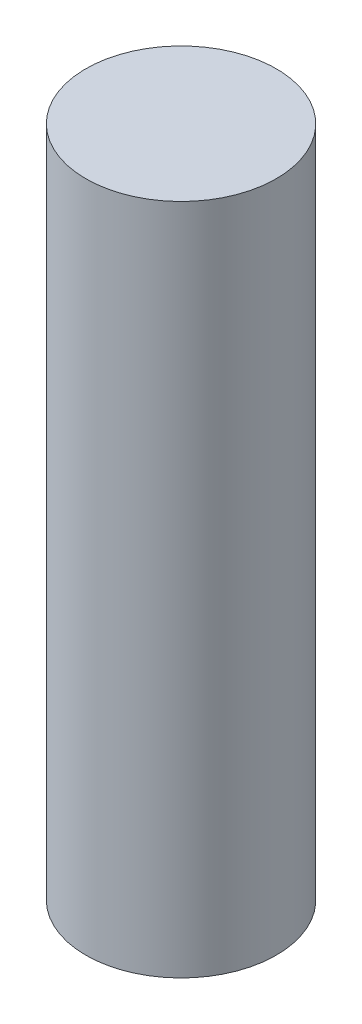
from build123d import *

# Parameters (mm, degrees)
SKETCH3_R           = 0.85
BOSS_EXTRUDE1_DEPTH = 6


with BuildPart() as part:
    # Sketch3 → Boss-Extrude1 (new body)
    with BuildSketch(Plane(origin=(0, 0, 0), x_dir=(1, 0, 0), z_dir=(0, 1, 0))):
        with Locations(Location((0, 0, 0), (0, 0, 270))):
            Circle(SKETCH3_R)
    extrude(amount=BOSS_EXTRUDE1_DEPTH)


solid = part.part
